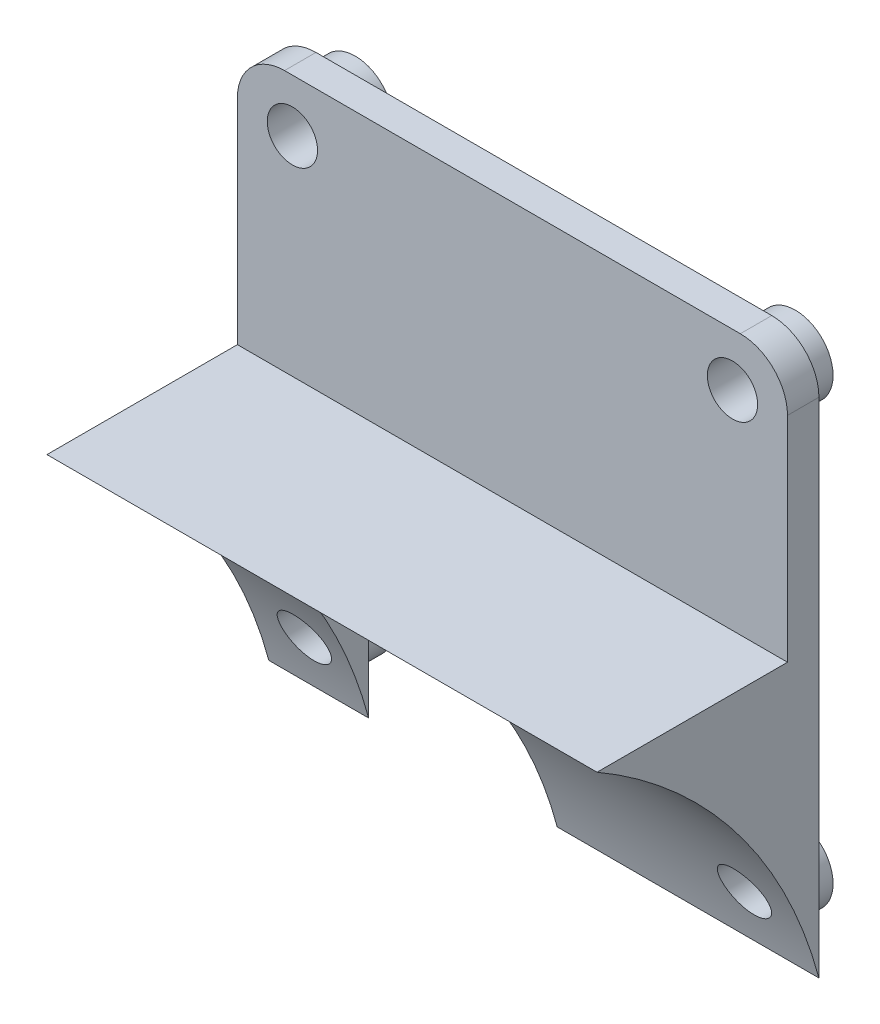
from build123d import *

# Parameters (mm, degrees)
SALIENTE_EXTRUIR1_DEPTH = 35
CROQUIS4_R              = 2
CORTAR_EXTRUIR1_DEPTH   = 2
CROQUIS5_R              = 1.25
CORTAR_EXTRUIR2_DEPTH   = 57.632946618
CROQUIS6_W              = 12
CROQUIS6_H              = 8
CORTAR_EXTRUIR3_DEPTH   = 58.094315502
CROQUIS7_R              = 2.4
CROQUIS7_R_2            = 1.6
SALIENTE_EXTRUIR3_DEPTH = 2
CROQUIS10_R             = 1.6
CORTAR_EXTRUIR6_DEPTH   = 58.094315502
REDONDEO1_R             = 3


with BuildPart() as part:
    # Croquis3 → Saliente-Extruir1 (new body)
    with BuildSketch(Plane(origin=(0, 0, 0), x_dir=(0, 0, -1), z_dir=(1, 0, 0))):
        with BuildLine():
            Line((15.15, 26.240569735), (27.267552537, 26.240569735))
            Line((27.267552537, 26.240569735), (27.267552537, 42.842217067))
            Line((27.267552537, 42.842217067), (29.267552537, 42.842217067))
            Line((29.267552537, 42.842217067), (29.267552537, 7.842217067))
            ThreePointArc((29.267552537, 7.842217067), (24.038606211, 18.445471299), (15.15, 26.240569735))
        make_face()
    extrude(amount=SALIENTE_EXTRUIR1_DEPTH)

    # Croquis4 → Cortar-Extruir1 (cut)
    with BuildSketch(Plane(origin=(0, 0, -29.267552537), x_dir=(-1, 0, 0), z_dir=(0, 0, -1))):
        with Locations((-25, 19.842217067)):
            Circle(CROQUIS4_R)
        with Locations((-10, 19.842217067)):
            Circle(CROQUIS4_R)
    extrude(amount=-CORTAR_EXTRUIR1_DEPTH, mode=Mode.SUBTRACT)

    # Croquis5 → Cortar-Extruir2 (cut, through all)
    with BuildSketch(Plane(origin=(0, 0, -27.267552537), x_dir=(-1, 0, 0), z_dir=(0, 0, -1))):
        with Locations((-25, 19.842217067)):
            Circle(CROQUIS5_R)
        with Locations((-10, 19.842217067)):
            Circle(CROQUIS5_R)
    extrude(amount=-CORTAR_EXTRUIR2_DEPTH, mode=Mode.SUBTRACT)

    # Croquis6 → Cortar-Extruir3 (cut, through all)
    with BuildSketch(Plane(origin=(0, 0, -29.267552537), x_dir=(-1, 0, 0), z_dir=(0, 0, -1))):
        with Locations((-12.35, 11.842217067)):
            Rectangle(CROQUIS6_W, CROQUIS6_H)
    extrude(amount=-CORTAR_EXTRUIR3_DEPTH, mode=Mode.SUBTRACT)

    # Croquis7 → Saliente-Extruir3 (add)
    # profile 1 of 4: a face of its own
    with BuildSketch(Plane(origin=(0, 0, -29.267552537), x_dir=(-1, 0, 0), z_dir=(0, 0, -1))):
        with Locations(Location((-31.5, 39.492217067, 0), (0, 0, 180))):
            Circle(CROQUIS7_R)
        with Locations((-31.5, 39.492217067)):
            Circle(CROQUIS7_R_2, mode=Mode.SUBTRACT)
    # profile 2 of 4: a face of its own
    with BuildSketch(Plane(origin=(0, 0, -29.267552537), x_dir=(-1, 0, 0), z_dir=(0, 0, -1))):
        with Locations(Location((-3.5, 39.492217067, 0), (0, 0, 180))):
            Circle(CROQUIS7_R)
        with Locations((-3.5, 39.492217067)):
            Circle(CROQUIS7_R_2, mode=Mode.SUBTRACT)
    # profile 3 of 4: a face of its own
    with BuildSketch(Plane(origin=(0, 0, -29.267552537), x_dir=(-1, 0, 0), z_dir=(0, 0, -1))):
        with Locations(Location((-3.5, 11.492217067, 0), (0, 0, 180))):
            Circle(CROQUIS7_R)
        with Locations((-3.5, 11.492217067)):
            Circle(CROQUIS7_R_2, mode=Mode.SUBTRACT)
    # profile 4 of 4: a face of its own
    with BuildSketch(Plane(origin=(0, 0, -29.267552537), x_dir=(-1, 0, 0), z_dir=(0, 0, -1))):
        with Locations(Location((-31.5, 11.492217067, 0), (0, 0, 180))):
            Circle(CROQUIS7_R)
        with Locations((-31.5, 11.492217067)):
            Circle(CROQUIS7_R_2, mode=Mode.SUBTRACT)
    extrude(amount=SALIENTE_EXTRUIR3_DEPTH)

    # Croquis10 → Cortar-Extruir6 (cut, through all)
    with BuildSketch(Plane(origin=(0, 0, -29.267552537), x_dir=(-1, 0, 0), z_dir=(0, 0, -1))):
        with Locations((-31.5, 11.492217067)):
            Circle(CROQUIS10_R)
        with Locations((-3.5, 11.492217067)):
            Circle(CROQUIS10_R)
        with Locations((-3.5, 39.492217067)):
            Circle(CROQUIS10_R)
        with Locations((-31.5, 39.492217067)):
            Circle(CROQUIS10_R)
    extrude(amount=-CORTAR_EXTRUIR6_DEPTH, mode=Mode.SUBTRACT)

    # Redondeo1
    redondeo1_edges = [part.edges().sort_by_distance(p)[0] for p in [
        (35, 42.842217067, -28.267552537),
        (0, 42.842217067, -28.267552537),
    ]]
    fillet(redondeo1_edges, radius=REDONDEO1_R)


solid = part.part
